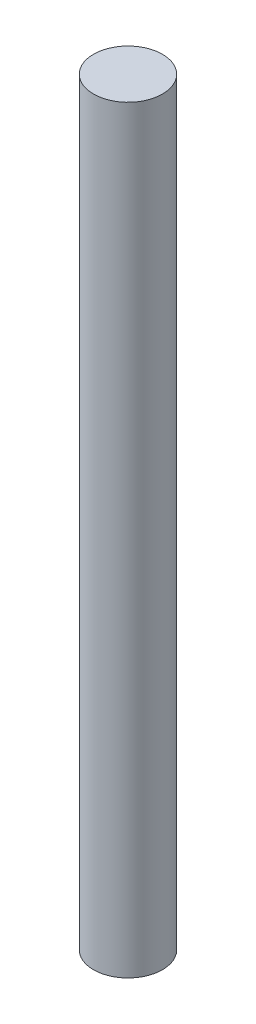
from build123d import *

# Parameters (mm, degrees)
SKETCH1_R           = 1
BOSS_EXTRUDE1_DEPTH = 22


with BuildPart() as part:
    # Sketch1 → Boss-Extrude1 (new body)
    with BuildSketch(Plane(origin=(0, 0, 0), x_dir=(1, 0, 0), z_dir=(0, 1, 0))):
        with Locations(Location((0, 0, 0), (0, 0, 270))):
            Circle(SKETCH1_R)
    extrude(amount=BOSS_EXTRUDE1_DEPTH)


solid = part.part
